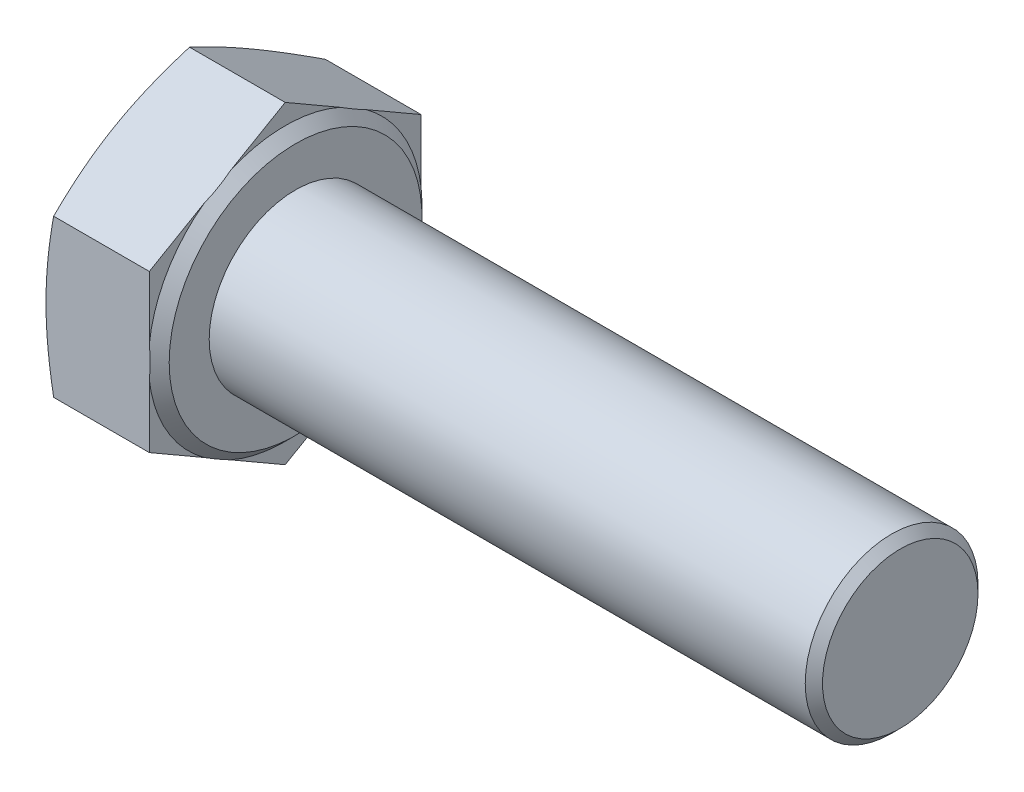
from build123d import *

# Parameters (mm, degrees)
BASEHEAD_DEPTH = 6.58
SKETCH5_R      = 5
BASEBODY_DEPTH = 35
CHAMFER1_SIZE  = 0.5


with BuildPart() as part:
    # Sketch2 → BaseHead (new body)
    with BuildSketch(Plane(origin=(0, 0, 0), x_dir=(0, 0, -1), z_dir=(1, 0, 0))):
        Polygon((7.865, -4.540859867), (7.865, 4.540859867), (0, 9.081719734), (-7.865, 4.540859867), (-7.865, -4.540859867), (0, -9.081719734), align=None)
    extrude(amount=BASEHEAD_DEPTH)

    # Sketch3 → BearingFace (revolve, cut)
    with BuildSketch(Plane.XY, mode=Mode.PRIVATE) as bearingface_sk:
        Polygon((6.58, 9.081719734), (6.58, 7.315), (5.98, 7.915), (5.98, 9.081719734), align=None)
    revolve(bearingface_sk.sketch.rotate(Axis((-0.957090588, 0, 0), (1, 0, 0)), 90), axis=Axis((-0.957090588, 0, 0), (1, 0, 0)), mode=Mode.SUBTRACT)

    # Sketch4 → HeadChamfer (revolve, cut)
    with BuildSketch(Plane.XY):
        Polygon((0, 9.081719734), (0.442849767, 9.081719734), (0, 7.865), align=None)
    revolve(axis=Axis((-0.493528746, 0, 0), (1, 0, 0)), mode=Mode.SUBTRACT)

    # Sketch5 → BaseBody (add)
    with BuildSketch(Plane(origin=(6.58, 0, 0), x_dir=(0, 0, -1), z_dir=(1, 0, 0))):
        with Locations(Location((0, 0, 0), (0, 0, 180))):
            Circle(SKETCH5_R)
    extrude(amount=BASEBODY_DEPTH)

    # Chamfer1
    chamfer1_edges = [part.edges().sort_by_distance(p)[0] for p in [
        (41.58, 0, -5),
    ]]
    chamfer(chamfer1_edges, length=CHAMFER1_SIZE)


solid = part.part
